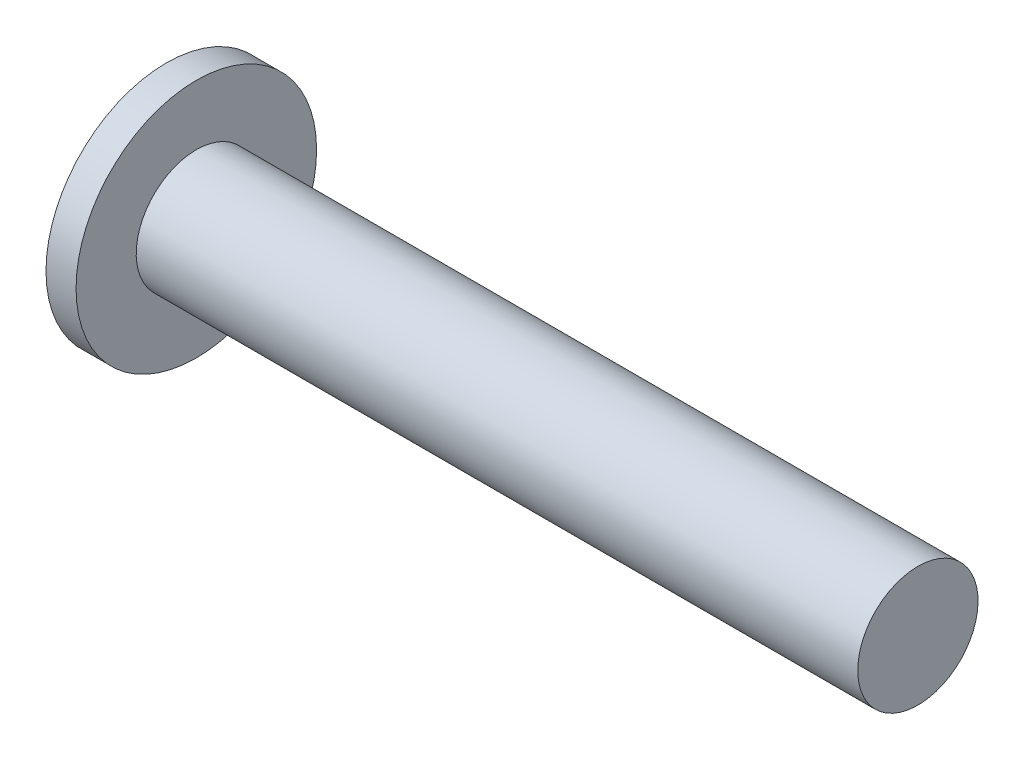
from build123d import *


with BuildPart() as part:
    # Sketch4 → Revolve1 (revolve)
    with BuildSketch(Plane.XY):
        Polygon((0, 0), (0, 40), (10, 40), (10, 20), (250, 20), (250, 0), align=None)
    revolve(axis=Axis((250, 0, 0), (-1, 0, 0)))


solid = part.part
